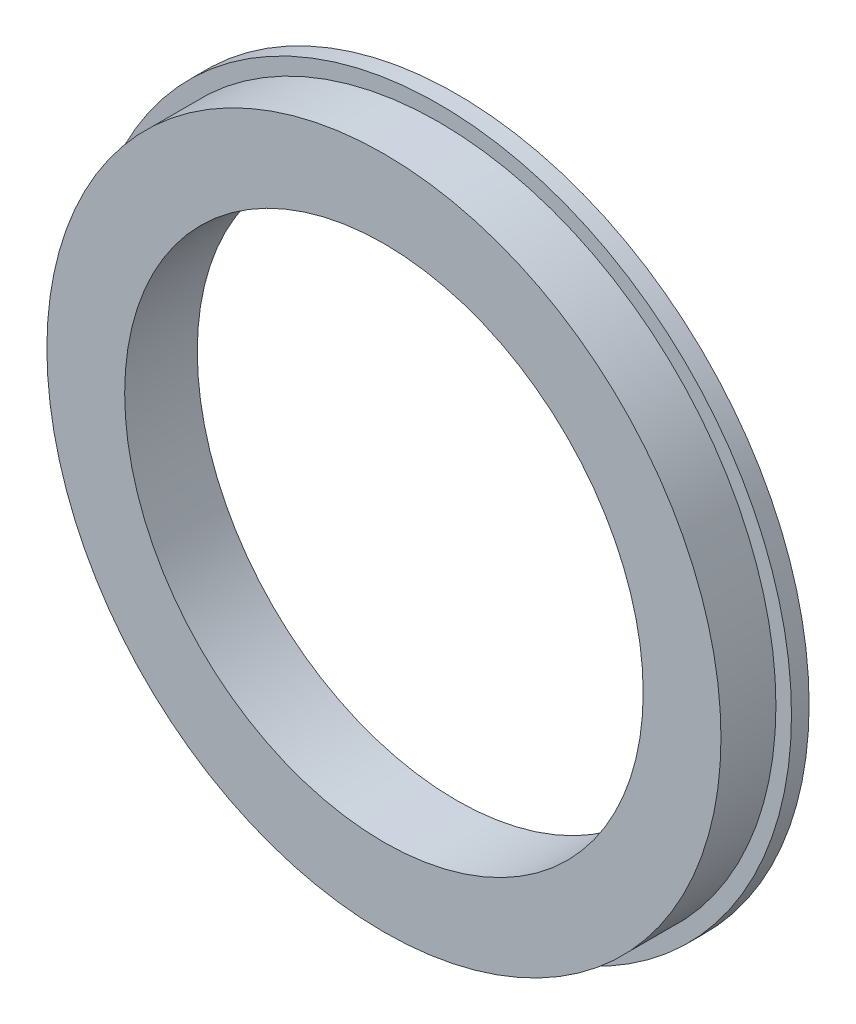
from build123d import *

# Parameters (mm, degrees)
SKETCH_1_R      = 32.5
SKETCH_1_R_2    = 25
EXTRUDE_1_DEPTH = 7
SKETCH_2_R      = 34
SKETCH_2_R_2    = 32.5
EXTRUDE_2_DEPTH = 1.7


with BuildPart() as part:
    # 草图1 → 凸台-拉伸1 (new body)
    with BuildSketch(Plane.XY):
        Circle(SKETCH_1_R)
        Circle(SKETCH_1_R_2, mode=Mode.SUBTRACT)
    extrude(amount=EXTRUDE_1_DEPTH)

    # 草图2 → 凸台-拉伸2 (add)
    with BuildSketch(Plane.XY):
        Circle(SKETCH_2_R)
        Circle(SKETCH_2_R_2, mode=Mode.SUBTRACT)
    extrude(amount=EXTRUDE_2_DEPTH)


solid = part.part
